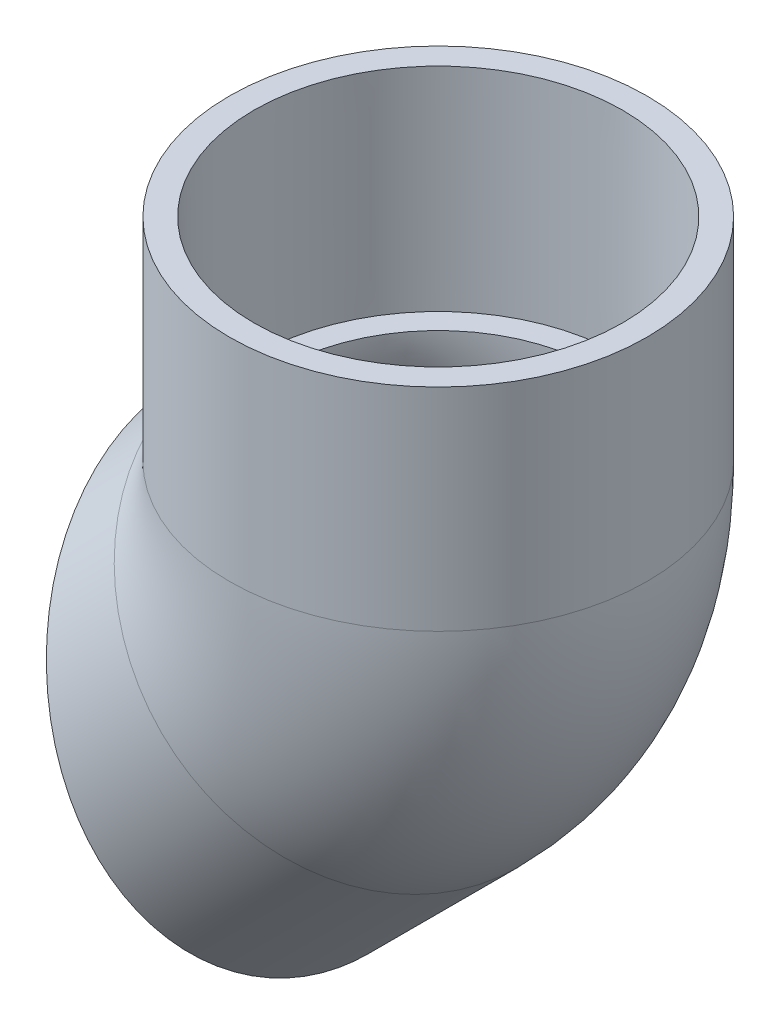
from build123d import *

# Parameters (mm, degrees)
SKETCH3_R               = 34.3535
SKETCH3_R_2             = 26.2509
CUT_EXTRUDE1_DEPTH      = 92.704245656
CUT_EXTRUDE1_DEPTH_BACK = 92.704245656


with BuildPart() as part:
    # Sketch1 → Revolve1 (revolve)
    with BuildSketch(Plane.XY):
        Polygon((-11.539629116, -60.122814731), (13.066272656, -35.516912959), (10.048906599, -32.499546902), (-14.395350562, -57.267093284), align=None)
    revolve(axis=Axis((-35.831221923, -35.831221923, 0), (0.7071067811865488, 0.7071067811865464, 0)))



with BuildPart() as body_2:
    # Sketch2 → Revolve2 (revolve)
    with BuildSketch(Plane.XY, mode=Mode.PRIVATE) as revolve2_sk:
        Polygon((30.3149, 50.673), (30.0863, 15.875), (34.3535, 15.875), (34.3535, 50.673), align=None)
    revolve(revolve2_sk.sketch.rotate(Axis((0, 0, 0), (0, 1, 0)), 90), axis=Axis((0, 0, 0), (0, 1, 0)))


with BuildPart() as part_1:
    add(part.part)

    add(body_2.part)  # Sweep1 merges body 2
    # Sweep1: sweep along a path in Sketch4
    with BuildLine(Plane.XY) as sweep1_path:
        ThreePointArc((-11.225320151, -11.225320151), (-2.917365657, 1.208412421), (0, 15.875))
    # Sketch3 → Sweep1 (sweep)
    with BuildSketch(Plane(origin=(-11.225320151, -11.225320151, 0), x_dir=(0, 0, -1), z_dir=(0.7071067811865486, 0.7071067811865465, 0))):
        Circle(SKETCH3_R)
        Circle(SKETCH3_R_2, mode=Mode.SUBTRACT)
    sweep(path=sweep1_path.line)

    # Sketch5 → Cut-Extrude1 (cut, two sides: drawn at the far end of the back side and taken through both)
    with BuildSketch(Plane.XY.offset(-CUT_EXTRUDE1_DEPTH_BACK)):
        Polygon((-42.162302488, 6.420883127), (-60.122814731, -11.539629116), (-11.539629116, -60.122814731), align=None)
    extrude(amount=CUT_EXTRUDE1_DEPTH + CUT_EXTRUDE1_DEPTH_BACK, mode=Mode.SUBTRACT)


solid = part_1.part
